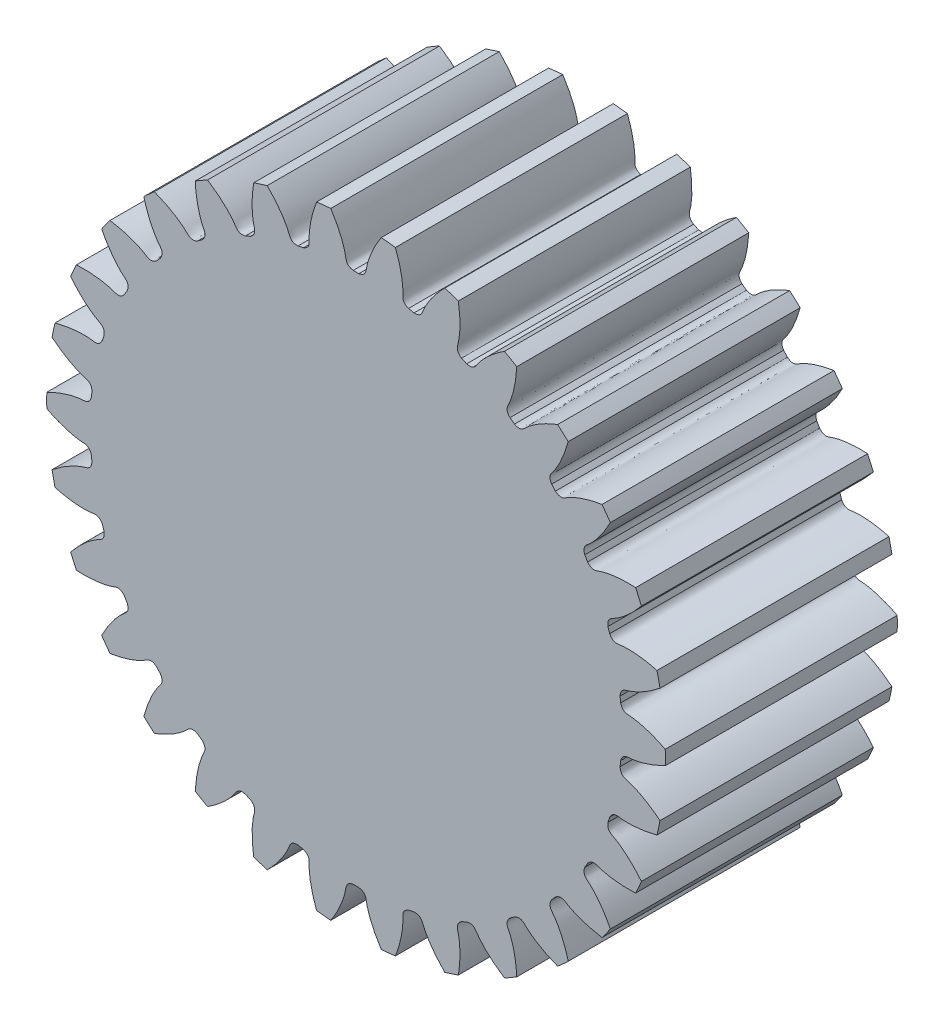
from build123d import *

# Parameters (mm, degrees)
SKETCH_1_R               = 40
EXTRUDE_1_DEPTH          = 30
CUT_EXTRUDE_1_DEPTH      = 65.031242374
PATTERN_CIRCULAR_1_COUNT = 30


with BuildPart() as part:
    # 草图1 → 凸台-拉伸1 (new body)
    with BuildSketch(Plane.XY):
        Circle(SKETCH_1_R)
    extrude(amount=EXTRUDE_1_DEPTH)

    # 草图2 → 切除-拉伸1 (cut, through all)
    with BuildSketch(Plane.XY):
        with BuildLine():
            ThreePointArc((0.363896572, 34.373073827), (0, 34.375), (-0.363896572, 34.373073827))
            add(Edge.make_bspline(
                [(-0.363896572, 34.373073827), (-1.270576724, 34.532437925), (-1.275761866, 35.11783159), (-1.39746205, 35.721447538), (-1.424876853, 35.845323094), (-1.458117716, 35.982312274), (-1.497669293, 36.132244981), (-1.544076559, 36.294912268), (-1.597858395, 36.470096285), (-1.659533781, 36.657561193), (-1.729613234, 36.857056152), (-1.808600854, 37.068314638), (-1.896993168, 37.291054875), (-1.995278941, 37.524979957), (-2.103938705, 37.769778067), (-2.223444379, 38.025122688), (-2.354258868, 38.290672819), (-2.496835675, 38.566073216), (-2.651618518, 38.850954625), (-2.819040947, 39.14493404), (-2.999525983, 39.44761496), (-3.193485739, 39.75858766), (-3.401321076, 40.077429471), (-3.623421238, 40.403705069), (-3.860163517, 40.736966769), (-4.111912911, 41.076754834), (-4.379021794, 41.42259779), (-4.661829597, 41.774012746), (-4.960662491, 42.130505726), (-5.27583308, 42.491572009), (-5.607640107, 42.856696476), (-5.956368162, 43.225353961), (-6.322287394, 43.597009618), (-6.705653277, 43.971119284), (-7.106706207, 44.347129863), (-7.672309665, 44.856552071), (-8.113361546, 45.230178828), (-8.415779579, 45.476395307)],
                knots=[0, 0, 0, 0, 0.115323882, 0.12341257, 0.132512303, 0.142623081, 0.153744905, 0.165877774, 0.179021689, 0.193176649, 0.208342655, 0.224519706, 0.241707802, 0.259906945, 0.279117132, 0.299338365, 0.320570644, 0.342813968, 0.366068337, 0.390333752, 0.415610213, 0.441897719, 0.46919627, 0.497505867, 0.52682651, 0.557158198, 0.588500931, 0.62085471, 0.654219534, 0.688595404, 0.723982319, 0.76038028, 0.797789286, 0.836209338, 0.875640435, 0.916082578, 1, 1, 1, 1], degree=3))
            ThreePointArc((-8.415779579, 45.476395307), (0, 46.248544583), (8.415779579, 45.476395307))
            add(Edge.make_bspline(
                [(0.363896572, 34.373073827), (1.270576724, 34.532437925), (1.275761866, 35.11783159), (1.39746205, 35.721447538), (1.424876853, 35.845323094), (1.458117716, 35.982312274), (1.497669293, 36.132244981), (1.544076559, 36.294912268), (1.597858395, 36.470096285), (1.659533781, 36.657561193), (1.729613234, 36.857056152), (1.808600854, 37.068314638), (1.896993168, 37.291054875), (1.995278941, 37.524979957), (2.103938705, 37.769778067), (2.223444379, 38.025122688), (2.354258868, 38.290672819), (2.496835675, 38.566073216), (2.651618518, 38.850954625), (2.819040947, 39.14493404), (2.999525983, 39.44761496), (3.193485739, 39.75858766), (3.401321076, 40.077429471), (3.623421238, 40.403705069), (3.860163517, 40.736966769), (4.111912911, 41.076754834), (4.379021794, 41.42259779), (4.661829597, 41.774012746), (4.960662491, 42.130505726), (5.27583308, 42.491572009), (5.607640107, 42.856696476), (5.956368162, 43.225353961), (6.322287394, 43.597009618), (6.705653277, 43.971119284), (7.106706207, 44.347129863), (7.672309665, 44.856552071), (8.113361546, 45.230178828), (8.415779579, 45.476395307)],
                knots=[0, 0, 0, 0, 0.115323882, 0.12341257, 0.132512303, 0.142623081, 0.153744905, 0.165877774, 0.179021689, 0.193176649, 0.208342655, 0.224519706, 0.241707802, 0.259906945, 0.279117132, 0.299338365, 0.320570644, 0.342813968, 0.366068337, 0.390333752, 0.415610213, 0.441897719, 0.46919627, 0.497505867, 0.52682651, 0.557158198, 0.588500931, 0.62085471, 0.654219534, 0.688595404, 0.723982319, 0.76038028, 0.797789286, 0.836209338, 0.875640435, 0.916082578, 1, 1, 1, 1], degree=3))
        make_face()
    cut_extrude_1 = extrude(amount=CUT_EXTRUDE_1_DEPTH, mode=Mode.SUBTRACT)

    # 阵列(圆周)1: 切除-拉伸1 ×30 about axis
    pattern_circular_1_axis = Axis((0, 0, 30), (0, 0, -1))
    for i in range(1, PATTERN_CIRCULAR_1_COUNT):
        add(cut_extrude_1.rotate(pattern_circular_1_axis, i * 360 / PATTERN_CIRCULAR_1_COUNT), mode=Mode.SUBTRACT)


solid = part.part
